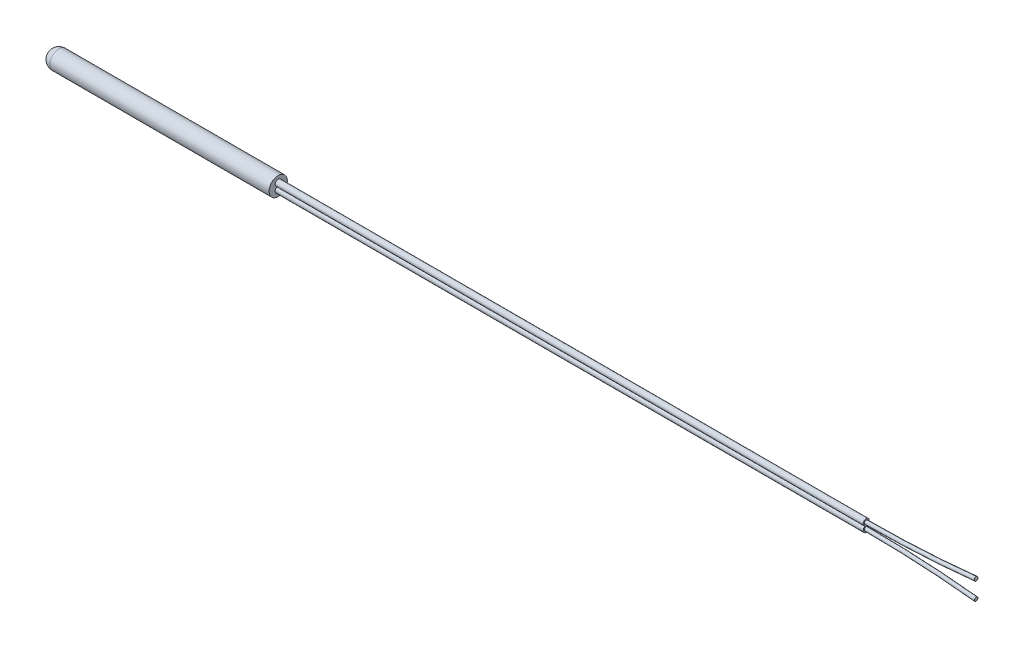
from build123d import *

# Parameters (mm, degrees)
SKETCH4_R = 0.077706682


with BuildPart() as part:
    # Sketch1 → Revolve1 (revolve)
    with BuildSketch(Plane.XY):
        with BuildLine():
            Line((0, 0), (9.525, 0))
            Line((9.525, 0), (9.525, 0.381))
            Line((9.525, 0.381), (0.381, 0.381))
            ThreePointArc((0.381, 0.381), (0.111592316, 0.269407684), (0, 0))
        make_face()
    revolve(axis=Axis((0, 0, 0), (1, 0, 0)))

    # Sweep1: sweep along a path in Sketch3
    with BuildLine(Plane(origin=(0, 0, 0), x_dir=(1, 0, 0), z_dir=(0, 1, 0))) as sweep1_path:
        Line((9.525, 0), (9.667412836, 0))
        Line((9.667412836, 0), (9.860608845, 0))
        Line((9.860608845, 0), (34.039598504, 0))
    # Sketch2 → Sweep1 (sweep)
    with BuildSketch(Plane(origin=(9.525, 0, 0), x_dir=(0, 0, -1), z_dir=(1, 0, 0))):
        with BuildLine():
            ThreePointArc((0.035971282, 0), (0, 0.248799289), (-0.035971282, 0))
            ThreePointArc((-0.035971282, 0), (0, -0.248799289), (0.035971282, 0))
        make_face()
    sweep(path=sweep1_path.line)

    # Sweep2: sweep along a path in Sketch5
    with BuildLine(Plane.XY) as sweep2_path:
        ThreePointArc((34.039598504, -0.121799289), (36.334226152, -0.183442101), (38.622234694, -0.368192721))
    # Sketch4 → Sweep2 (sweep)
    with BuildSketch(Plane(origin=(34.039598504, 0, 0), x_dir=(0, 0, -1), z_dir=(1, 0, 0))):
        with Locations((0, -0.121799289)):
            Circle(SKETCH4_R)
    sweep2 = sweep(path=sweep2_path.line)

    # Mirror1: Sweep2 across plane
    add(sweep2.mirror(Plane.ZX))


solid = part.part
